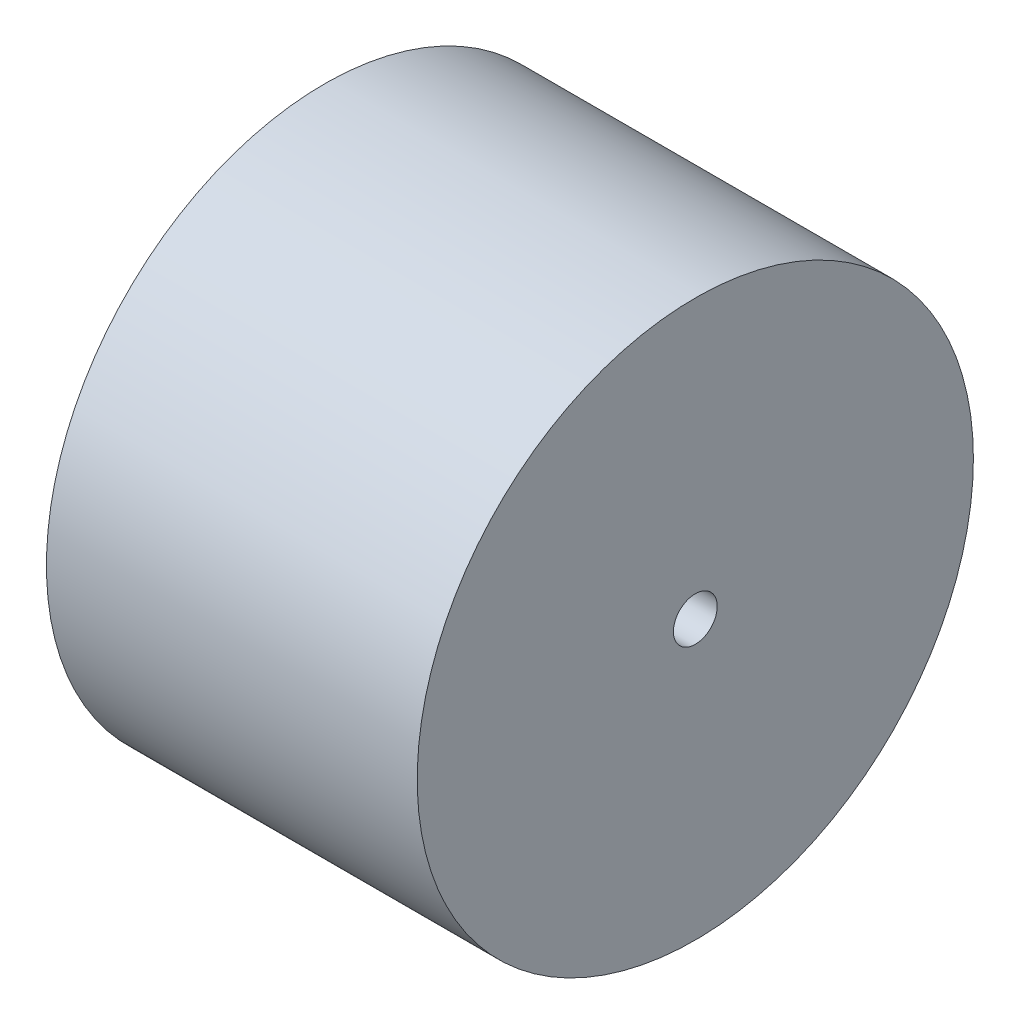
from build123d import *

# Parameters (mm, degrees)
SKETCH1_R           = 19.05
SKETCH1_R_2         = 1.5
BOSS_EXTRUDE1_DEPTH = 12.7


with BuildPart() as part:
    # Sketch1 → Boss-Extrude1 (new, symmetric)
    with BuildSketch(Plane(origin=(0, 0, 0), x_dir=(0, 0, -1), z_dir=(1, 0, 0))):
        Circle(SKETCH1_R)
        Circle(SKETCH1_R_2, mode=Mode.SUBTRACT)
    extrude(amount=BOSS_EXTRUDE1_DEPTH, both=True)


solid = part.part
